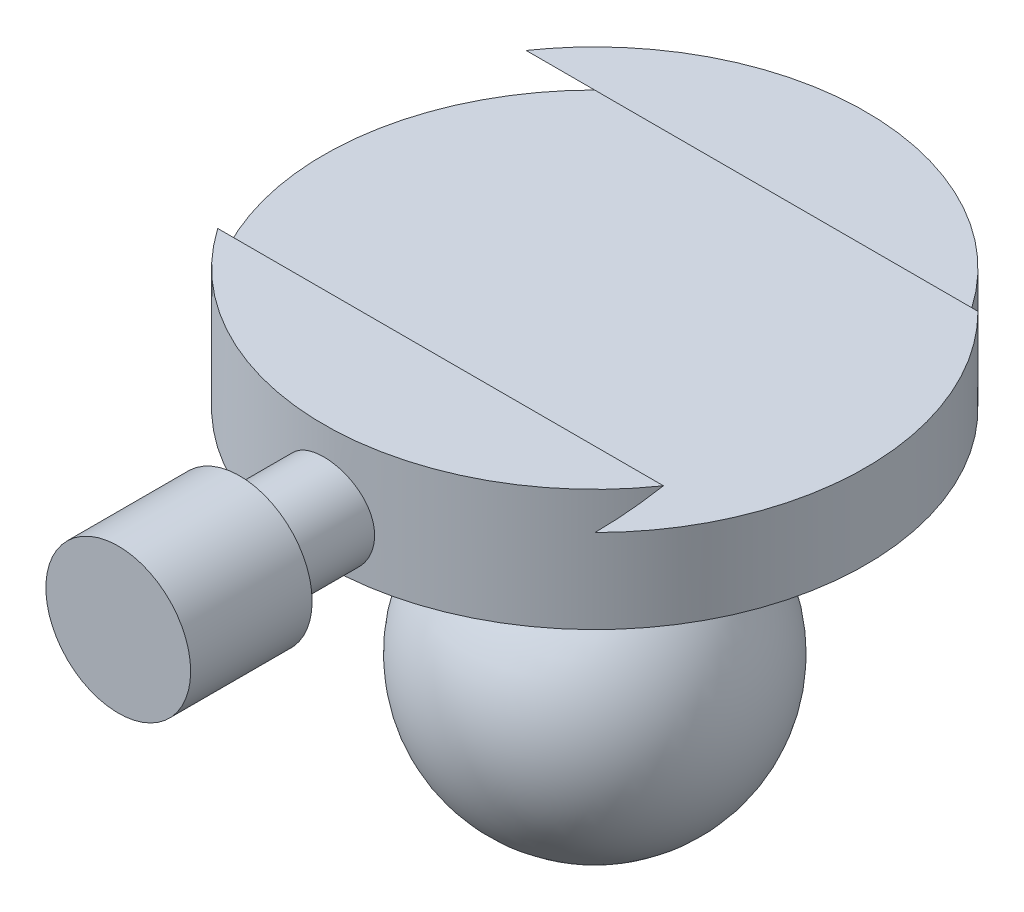
from build123d import *

# Parameters (mm, degrees)
SKETCH_2_R               = 29
EXTRUDE_1_DEPTH          = 13
SKETCH_3_R               = 5
EXTRUDE_2_DEPTH          = 37
SKETCH_4_R               = 5
EXTRUDE_3_DEPTH          = 1
EXTRUDE_3_DRAFT          = -70
SKETCH_5_R               = 7.747477419
EXTRUDE_4_DEPTH          = 13
CUT_EXTRUDE_1_DEPTH      = 69.696273115
CUT_EXTRUDE_1_DEPTH_BACK = 69.696273115


with BuildPart() as part:
    # 草图1 → 旋转1 (revolve)
    with BuildSketch(Plane.XY, mode=Mode.PRIVATE) as revolve_1_sk:
        with BuildLine():
            Line((0, -16), (0, 22.737626207))
            Line((0, 22.737626207), (7, 22.737626207))
            Line((7, 22.737626207), (7, 17.237626207))
            Line((7, 17.237626207), (7.3, 17.237626207))
            Line((7.3, 17.237626207), (7.3, 14.237626207))
            ThreePointArc((7.3, 14.237626207), (15.55316719, -3.754862227), (0, -16))
        make_face()
    revolve(revolve_1_sk.sketch.rotate(Axis((0, -16, 0), (0, 1, 0)), 90), axis=Axis((0, -16, 0), (0, 1, 0)))

    # 草图2 → 凸台-拉伸1 (add)
    with BuildSketch(Plane(origin=(0, 22.737626207, 0), x_dir=(1, 0, 0), z_dir=(0, 1, 0))):
        with Locations(Location((0, 0, 0), (0, 0, 90))):
            Circle(SKETCH_2_R)
    extrude(amount=EXTRUDE_1_DEPTH)

    # 草图3 → 凸台-拉伸2 (add)
    with BuildSketch(Plane.XY):
        with Locations(Location((0, 27.737626207, 0), (0, 0, 90))):
            Circle(SKETCH_3_R)
    extrude(amount=EXTRUDE_2_DEPTH)


with BuildPart() as extrude_3_tool:
    # 草图4 → 凸台-拉伸3 (with draft: the straight prism first)
    with BuildSketch(Plane.XY.offset(37)):
        with Locations(Location((0, 27.737626207, 0), (0, 0, 90))):
            Circle(SKETCH_4_R)
    extrude(amount=EXTRUDE_3_DEPTH)
    # 凸台-拉伸3: the draft: its side faces are tilted about the plane it starts from
    extrude_3_sides = [extrude_3_tool.faces().sort_by_distance(p)[0] for p in [
        (0, 22.737626207, 37.5),
    ]]
    draft(extrude_3_sides, Plane.XY.offset(37), EXTRUDE_3_DRAFT)


with BuildPart() as part_1:
    add(part.part)

    # 凸台-拉伸3: add extrude_3_tool
    add(extrude_3_tool.part)

    # 草图5 → 凸台-拉伸4 (add)
    with BuildSketch(Plane.XY.offset(38)):
        with Locations((0, 27.737626207)):
            Circle(SKETCH_5_R)
    extrude(amount=EXTRUDE_4_DEPTH)

    # 草图6 → 切除-拉伸1 (cut, two sides: drawn at the far end of the back side and taken through both)
    with BuildSketch(Plane(origin=(0, 0, 0), x_dir=(0, 0, -1), z_dir=(1, 0, 0)).offset(-CUT_EXTRUDE_1_DEPTH_BACK)):
        Polygon((-16.5, 35.737626207), (16.5, 35.737626207), (20.5, 31.737626207), (-20.5, 31.737626207), align=None)
    extrude(amount=CUT_EXTRUDE_1_DEPTH + CUT_EXTRUDE_1_DEPTH_BACK, mode=Mode.SUBTRACT)


solid = part_1.part
